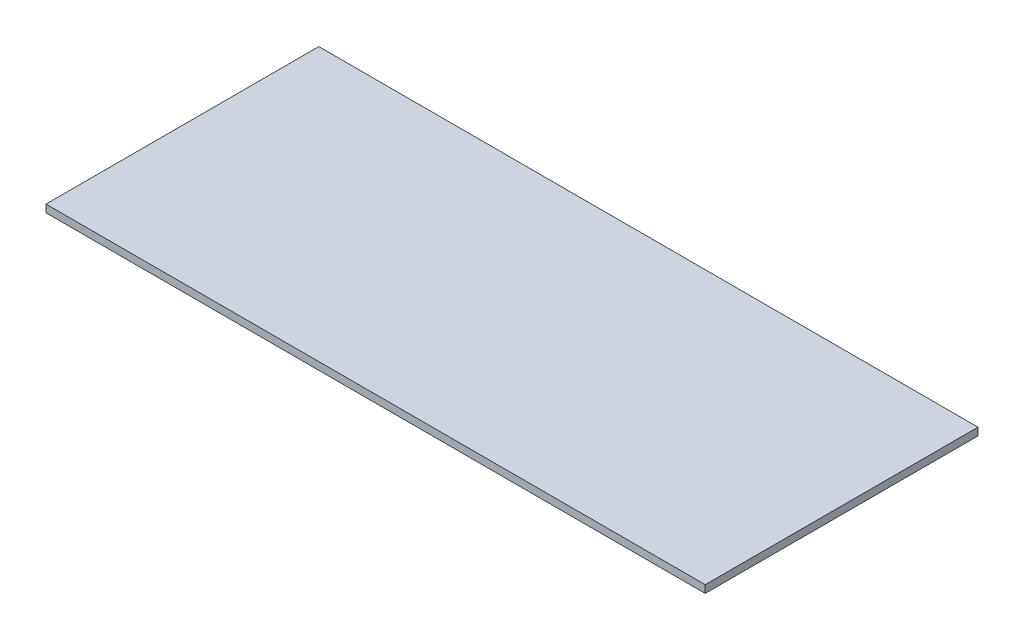
from build123d import *

# Parameters (mm, degrees)
SKETCH1_W           = 174
SKETCH1_H           = 72
BOSS_EXTRUDE1_DEPTH = 1


with BuildPart() as part:
    # Sketch1 → Boss-Extrude1 (new, symmetric)
    with BuildSketch(Plane(origin=(0, 0, 0), x_dir=(1, 0, 0), z_dir=(0, 1, 0))):
        Rectangle(SKETCH1_W, SKETCH1_H)
    extrude(amount=BOSS_EXTRUDE1_DEPTH, both=True)


solid = part.part
